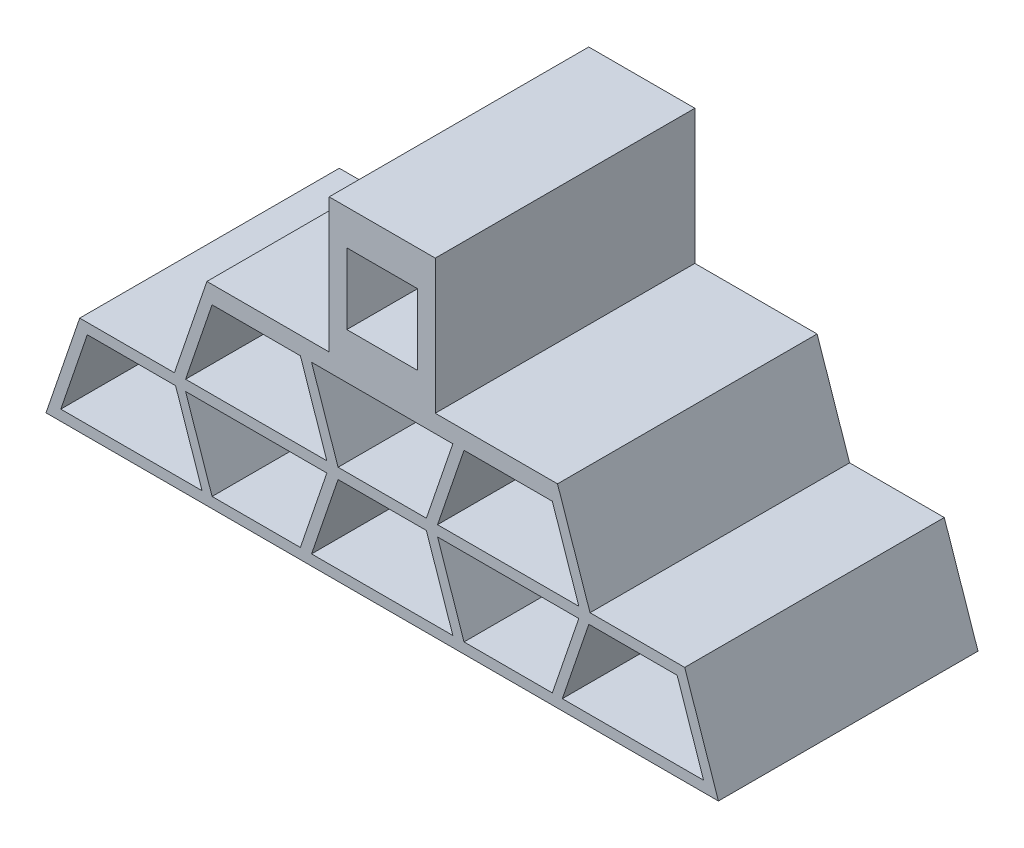
from build123d import *

# Parameters (mm, degrees)
SKETCH1_W           = 20.045
SKETCH1_H           = 20.045
BOSS_EXTRUDE1_DEPTH = 73.5


with BuildPart() as part:
    # Sketch1 → Boss-Extrude1 (new body)
    with BuildSketch(Plane.XY):
        Polygon((-95.192265263, -73.0225), (95.192265263, -73.0225), (85.646810718, -45.0225), (58.839075981, -45.0225), (49.634530527, -18.0225), (15.0225, -18.0225), (15.0225, 20.0225), (-15.0225, 20.0225), (-15.0225, -18.0225), (-49.634530527, -18.0225), (-58.839075981, -45.0225), (-85.646810718, -45.0225), align=None)
        Rectangle(SKETCH1_W, SKETCH1_H, mode=Mode.SUBTRACT)
        Polygon((-20, -23.0225), (20, -23.0225), (12.5, -45.0225), (-12.5, -45.0225), align=None, mode=Mode.SUBTRACT)
        Polygon((23.169537991, -23.0225), (15.669537991, -45.0225), (55.669537991, -45.0225), (48.169537991, -23.0225), align=None, mode=Mode.SUBTRACT)
        Polygon((-55.669537991, -45.0225), (-48.169537991, -23.0225), (-23.169537991, -23.0225), (-15.669537991, -45.0225), align=None, mode=Mode.SUBTRACT)
        Polygon((55.669537991, -48.0225), (48.169537991, -70.0225), (23.169537991, -70.0225), (15.669537991, -48.0225), align=None, mode=Mode.SUBTRACT)
        Polygon((-20, -70.0225), (-12.5, -48.0225), (12.5, -48.0225), (20, -70.0225), align=None, mode=Mode.SUBTRACT)
        Polygon((-15.669537991, -48.0225), (-55.669537991, -48.0225), (-48.169537991, -70.0225), (-23.169537991, -70.0225), align=None, mode=Mode.SUBTRACT)
        Polygon((51, -70.0225), (58.5, -48.0225), (83.5, -48.0225), (91, -70.0225), align=None, mode=Mode.SUBTRACT)
        Polygon((-91, -70.0225), (-83.5, -48.0225), (-58.5, -48.0225), (-51, -70.0225), align=None, mode=Mode.SUBTRACT)
    extrude(amount=BOSS_EXTRUDE1_DEPTH)


solid = part.part
